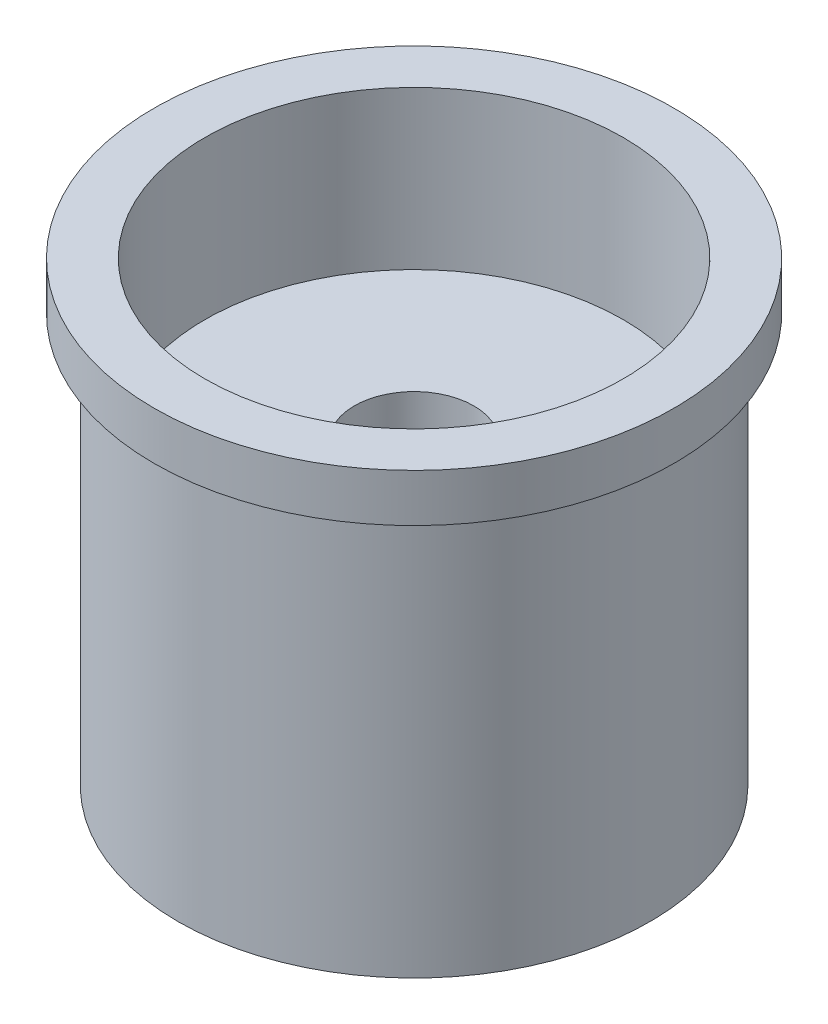
from build123d import *

# Parameters (mm, degrees)
SKETCH_1_R          = 19.75
EXTRUDE_1_DEPTH     = 34.2
SKETCH_2_R          = 21.75
EXTRUDE_2_DEPTH     = 4
SKETCH_3_R          = 5
CUT_EXTRUDE_1_DEPTH = 25
SKETCH_4_R          = 17.5
CUT_EXTRUDE_3_DEPTH = 13.2


with BuildPart() as part:
    # 草图1 → 凸台-拉伸1 (new body)
    with BuildSketch(Plane(origin=(0, 0, 0), x_dir=(1, 0, 0), z_dir=(0, 1, 0))):
        with Locations(Location((0, 0, 0), (0, 0, 270))):
            Circle(SKETCH_1_R)
    extrude(amount=EXTRUDE_1_DEPTH)

    # 草图2 → 凸台-拉伸2 (add)
    with BuildSketch(Plane(origin=(0, 34.2, 0), x_dir=(1, 0, 0), z_dir=(0, 1, 0))):
        with Locations(Location((0, 0, 0), (0, 0, 270))):
            Circle(SKETCH_2_R)
    extrude(amount=EXTRUDE_2_DEPTH)

    # 草图3 → 切除-拉伸1 (cut)
    with BuildSketch(Plane.XZ):
        with Locations(Location((0, 0, 0), (0, 0, 270))):
            Circle(SKETCH_3_R)
    extrude(amount=-CUT_EXTRUDE_1_DEPTH, mode=Mode.SUBTRACT)

    # 草图4 → 切除-拉伸3 (cut)
    with BuildSketch(Plane(origin=(0, 38.2, 0), x_dir=(1, 0, 0), z_dir=(0, 1, 0))):
        with Locations(Location((0, 0, 0), (0, 0, 270))):
            Circle(SKETCH_4_R)
    extrude(amount=-CUT_EXTRUDE_3_DEPTH, mode=Mode.SUBTRACT)


solid = part.part
